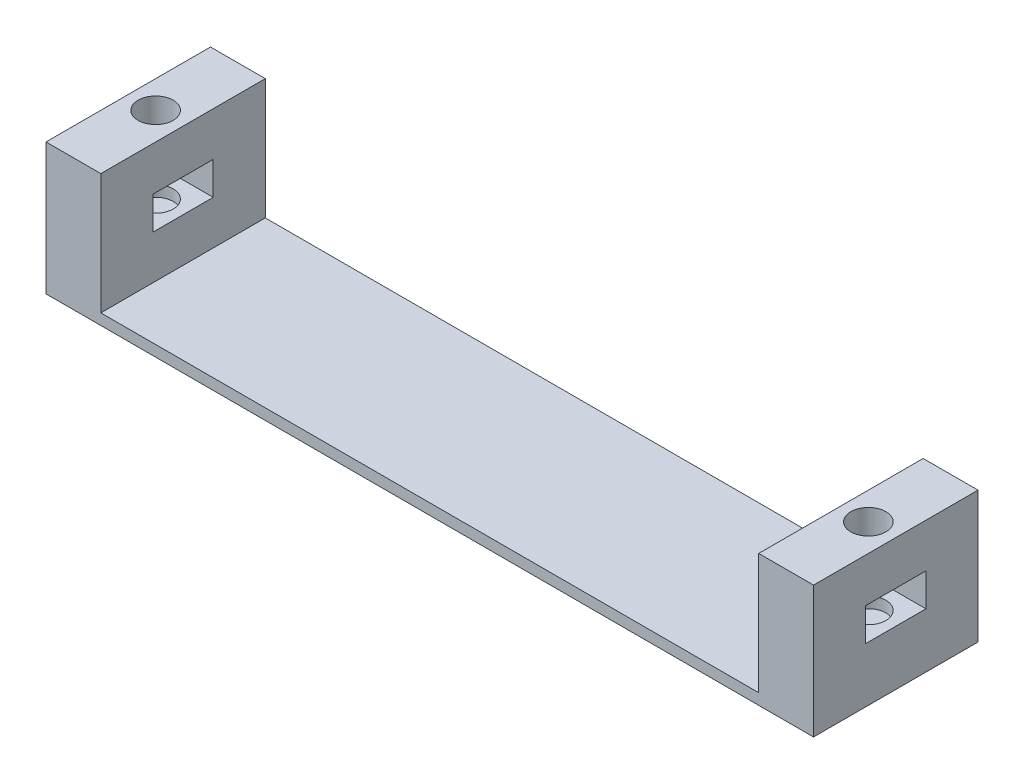
from build123d import *

# Parameters (mm, degrees)
SKETCH1_W           = 70
SKETCH1_H           = 15
BOSS_EXTRUDE1_DEPTH = 1
SKETCH2_W           = 5
SKETCH2_H           = 15
BOSS_EXTRUDE2_DEPTH = 11
SKETCH3_R           = 1.6
CUT_EXTRUDE1_DEPTH  = 8
SKETCH4_W           = 5.5
SKETCH4_H           = 3
CUT_EXTRUDE2_DEPTH  = 72.416034614


with BuildPart() as part:
    # Sketch1 → Boss-Extrude1 (new body)
    with BuildSketch(Plane(origin=(0, 0, 0), x_dir=(1, 0, 0), z_dir=(0, 1, 0))):
        Rectangle(SKETCH1_W, SKETCH1_H)
    extrude(amount=BOSS_EXTRUDE1_DEPTH)

    # Sketch2 → Boss-Extrude2 (add)
    with BuildSketch(Plane(origin=(0, 1, 0), x_dir=(1, 0, 0), z_dir=(0, 1, 0))):
        with Locations((-32.5, 0)):
            Rectangle(SKETCH2_W, SKETCH2_H)
        with Locations((32.5, 0)):
            Rectangle(SKETCH2_W, SKETCH2_H)
    extrude(amount=BOSS_EXTRUDE2_DEPTH)

    # Sketch3 → Cut-Extrude1 (cut)
    with BuildSketch(Plane(origin=(0, 12, 0), x_dir=(1, 0, 0), z_dir=(0, 1, 0))):
        with Locations(Location((-32.5, 0, 0), (0, 0, 270))):
            Circle(SKETCH3_R)
        with Locations(Location((32.5, 0, 0), (0, 0, 90))):
            Circle(SKETCH3_R)
    extrude(amount=-CUT_EXTRUDE1_DEPTH, mode=Mode.SUBTRACT)

    # Sketch4 → Cut-Extrude2 (cut, through all)
    with BuildSketch(Plane(origin=(35, 0, 0), x_dir=(0, 0, -1), z_dir=(1, 0, 0))):
        with Locations((0, 6.5)):
            Rectangle(SKETCH4_W, SKETCH4_H)
    extrude(amount=-CUT_EXTRUDE2_DEPTH, mode=Mode.SUBTRACT)


solid = part.part
